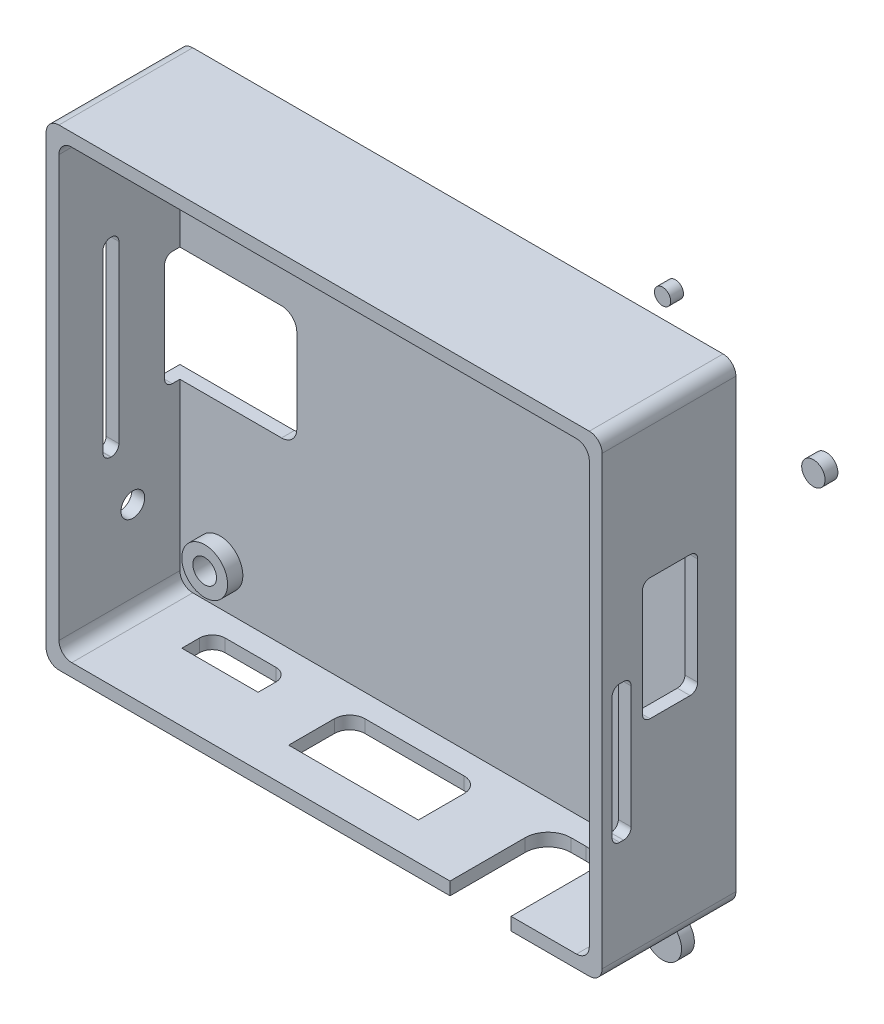
from build123d import *

# Parameters (mm, degrees)
SKETCH_1_R          = 1.531489915
EXTRUDE_1_DEPTH     = 1.68
SKETCH_1_R_2        = 1.063949022
EXTRUDE_1_2_DEPTH   = 1.68
SKETCH_1_R_3        = 2.489250022
EXTRUDE_1_3_DEPTH   = 1.68
SKETCH_1_W          = 72.86
SKETCH_1_H          = 61.86
SKETCH_1_R_4        = 1.55
EXTRUDE_1_4_DEPTH   = 1.68
SKETCH_2_R          = 3
SKETCH_2_R_2        = 1.55
EXTRUDE_3_DEPTH     = 2
SKETCH_3_W          = 72.86
SKETCH_3_H          = 61.86
SKETCH_3_W_2        = 69.50125591
SKETCH_3_H_2        = 58.5
EXTRUDE_4_DEPTH     = 15.85
SKETCH_4_W          = 17
SKETCH_4_H          = 15
CUT_EXTRUDE_1_DEPTH = 3.68
SKETCH_6_W          = 7.25
SKETCH_6_H          = 16
SKETCH_6_W_2        = 2.5
SKETCH_6_H_2        = 18
CUT_EXTRUDE_3_DEPTH = 7.8
SKETCH_7_W          = 10
SKETCH_7_H          = 4
SKETCH_7_W_2        = 17
SKETCH_7_H_2        = 8
SKETCH_7_W_3        = 8
SKETCH_7_H_3        = 13.300256909
CUT_EXTRUDE_5_DEPTH = 2
SKETCH_8_R          = 1.556852558
SKETCH_8_W          = 2.087452415
SKETCH_8_H          = 24.945353107
CUT_EXTRUDE_6_DEPTH = 2
FILLET_1_R          = 1.68
FILLET_2_R          = 2
FILLET_3_R          = 1.68
FILLET_4_R          = 2
FILLET_5_R          = 3
FILLET_6_R          = 1
FILLET_7_R          = 1
SKETCH_9_R          = 4
CUT_EXTRUDE_7_DEPTH = 0.8
SKETCH_10_W         = 44.758598589
SKETCH_10_H         = 6.5
SKETCH_10_W_2       = 44.448850503
CUT_EXTRUDE_8_DEPTH = 0.8


with BuildPart() as part:
    # 草图1 → 凸台-拉伸1 (new body)
    with BuildSketch(Plane.XY):
        with Locations((1.504266973, 51.672660554)):
            Circle(SKETCH_1_R)
    extrude(amount=EXTRUDE_1_DEPTH)


with BuildPart() as body_2:
    # 草图1 → Extrude 1 2 (new body)
    with BuildSketch(Plane.XY):
        with Locations((-18.258772408, 61.840992468)):
            Circle(SKETCH_1_R_2)
    extrude(amount=EXTRUDE_1_2_DEPTH)


with BuildPart() as body_3:
    # 草图1 → Extrude 1 3 (new body)
    with BuildSketch(Plane.XY):
        with Locations((-18.258772408, -10.975845657)):
            Circle(SKETCH_1_R_3)
    extrude(amount=EXTRUDE_1_3_DEPTH)


with BuildPart() as body_4:
    # 草图1 → Extrude 1 4 (new body)
    with BuildSketch(Plane.XY):
        with Locations((-46.758772408, 26.672660554)):
            Rectangle(SKETCH_1_W, SKETCH_1_H)
        with Locations((-76.258772408, 51.672660554)):
            Circle(SKETCH_1_R_4, mode=Mode.SUBTRACT)
        with Locations((-18.258772408, 51.672660554)):
            Circle(SKETCH_1_R_4, mode=Mode.SUBTRACT)
        with Locations((-76.258772408, 2.672660554)):
            Circle(SKETCH_1_R_4, mode=Mode.SUBTRACT)
        with Locations((-18.258772408, 2.672660554)):
            Circle(SKETCH_1_R_4, mode=Mode.SUBTRACT)
    extrude(amount=EXTRUDE_1_4_DEPTH)

    # 草图2 → 凸台-拉伸3 (add)
    # profile 1 of 4: a face of its own
    with BuildSketch(Plane.XY.offset(1.68)):
        with Locations((-76.258772408, 2.672660554)):
            Circle(SKETCH_2_R)
        with Locations((-76.258772408, 2.672660554)):
            Circle(SKETCH_2_R_2, mode=Mode.SUBTRACT)
    # profile 2 of 4: a face of its own
    with BuildSketch(Plane.XY.offset(1.68)):
        with Locations((-18.258772408, 2.672660554)):
            Circle(SKETCH_2_R)
        with Locations((-18.258772408, 2.672660554)):
            Circle(SKETCH_2_R_2, mode=Mode.SUBTRACT)
    # profile 3 of 4: a face of its own
    with BuildSketch(Plane.XY.offset(1.68)):
        with Locations((-76.258772408, 51.672660554)):
            Circle(SKETCH_2_R)
        with Locations((-76.258772408, 51.672660554)):
            Circle(SKETCH_2_R_2, mode=Mode.SUBTRACT)
    # profile 4 of 4: a face of its own
    with BuildSketch(Plane.XY.offset(1.68)):
        with Locations((-18.258772408, 51.672660554)):
            Circle(SKETCH_2_R)
        with Locations((-18.258772408, 51.672660554)):
            Circle(SKETCH_2_R_2, mode=Mode.SUBTRACT)
    extrude(amount=EXTRUDE_3_DEPTH)

    # 草图3 → 凸台-拉伸4 (add)
    with BuildSketch(Plane.XY.offset(1.68)):
        with Locations((-46.758772408, 26.672660554)):
            Rectangle(SKETCH_3_W, SKETCH_3_H)
        with Locations((-46.758144453, 26.672660554)):
            Rectangle(SKETCH_3_W_2, SKETCH_3_H_2, mode=Mode.SUBTRACT)
    extrude(amount=EXTRUDE_4_DEPTH)

    # 草图4 → 切除-拉伸1 (cut)
    with BuildSketch(Plane(origin=(0, 0, 0), x_dir=(-1, 0, 0), z_dir=(0, 0, -1))):
        with Locations((74.688772408, 28.322197805)):
            Rectangle(SKETCH_4_W, SKETCH_4_H)
    extrude(amount=-CUT_EXTRUDE_1_DEPTH, mode=Mode.SUBTRACT)

    # 草图6 → 切除-拉伸3 (cut)
    with BuildSketch(Plane(origin=(-10.328772408, 0, 0), x_dir=(0, 0, -1), z_dir=(1, 0, 0))):
        with Locations((-8.625, 30.672660554)):
            Rectangle(SKETCH_6_W, SKETCH_6_H)
        with Locations((-14.975303343, 19.628822862)):
            Rectangle(SKETCH_6_W_2, SKETCH_6_H_2)
    extrude(amount=-CUT_EXTRUDE_3_DEPTH, mode=Mode.SUBTRACT)

    # 草图7 → 切除-拉伸5 (cut)
    with BuildSketch(Plane.XZ.offset(4.257339446)):
        with Locations((-69.258772408, 6.68)):
            Rectangle(SKETCH_7_W, SKETCH_7_H)
        with Locations((-47.758772408, 8.68)):
            Rectangle(SKETCH_7_W_2, SKETCH_7_H_2)
        with Locations((-26.258772408, 11.330128455)):
            Rectangle(SKETCH_7_W_3, SKETCH_7_H_3)
    extrude(amount=-CUT_EXTRUDE_5_DEPTH, mode=Mode.SUBTRACT)

    # 草图8 → 切除-拉伸6 (cut)
    with BuildSketch(Plane.ZY.offset(83.188772408)):
        with Locations((7.843859074, 9.687980695)):
            Circle(SKETCH_8_R)
        with Locations((10.717951448, 28.982792683)):
            Rectangle(SKETCH_8_W, SKETCH_8_H)
    extrude(amount=-CUT_EXTRUDE_6_DEPTH, mode=Mode.SUBTRACT)

    # 圆角1
    fillet_1_edges = [body_4.edges().sort_by_distance(p)[0] for p in [
        (-12.007516498, 55.922660554, 9.605),
        (-81.508772408, 55.922660554, 9.605),
        (-81.508772408, -2.577339446, 9.605),
        (-12.007516498, -2.577339446, 9.605),
        (-10.328772408, -4.257339446, 8.765),
        (-83.188772408, -4.257339446, 8.765),
        (-83.188772408, 57.602660554, 8.765),
        (-10.328772408, 57.602660554, 8.765),
    ]]
    fillet(fillet_1_edges, radius=FILLET_1_R)

    # 圆角2
    fillet_2_edges = [body_4.edges().sort_by_distance(p)[0] for p in [
        (-66.188772408, 20.822197805, 0.84),
        (-66.188772408, 35.822197805, 0.84),
    ]]
    fillet(fillet_2_edges, radius=FILLET_2_R)

    # 圆角3
    fillet_3_edges = [body_4.edges().sort_by_distance(p)[0] for p in [
        (-74.258772408, -3.417339446, 4.68),
        (-64.258772408, -3.417339446, 4.68),
    ]]
    fillet(fillet_3_edges, radius=FILLET_3_R)

    # 圆角4
    fillet_4_edges = [body_4.edges().sort_by_distance(p)[0] for p in [
        (-56.258772408, -3.417339446, 4.68),
        (-39.258772408, -3.417339446, 4.68),
    ]]
    fillet(fillet_4_edges, radius=FILLET_4_R)

    # 圆角5
    fillet_5_edges = [body_4.edges().sort_by_distance(p)[0] for p in [
        (-30.258772408, -3.417339446, 4.68),
        (-22.258772408, -3.417339446, 4.68),
    ]]
    fillet(fillet_5_edges, radius=FILLET_5_R)

    # 圆角6
    fillet_6_edges = [body_4.edges().sort_by_distance(p)[0] for p in [
        (-11.168144453, 10.628822862, 16.225303343),
        (-11.168144453, 28.628822862, 16.225303343),
        (-11.168144453, 28.628822862, 13.725303343),
        (-11.168144453, 10.628822862, 13.725303343),
    ]]
    fillet(fillet_6_edges, radius=FILLET_6_R)

    # 圆角7
    fillet_7_edges = [body_4.edges().sort_by_distance(p)[0] for p in [
        (-11.168144453, 38.672660554, 5),
        (-11.168144453, 22.672660554, 5),
        (-11.168144453, 22.672660554, 12.25),
        (-11.168144453, 38.672660554, 12.25),
        (-82.348772408, 16.510116129, 9.67422524),
        (-82.348772408, 41.455469236, 9.67422524),
        (-82.348772408, 41.455469236, 11.761677655),
        (-82.348772408, 16.510116129, 11.761677655),
        (-82.348772408, 20.822197805, 3.68),
        (-82.348772408, 35.822197805, 3.68),
    ]]
    fillet(fillet_7_edges, radius=FILLET_7_R)

    # 草图9 → 切除-拉伸7 (cut)
    with BuildSketch(Plane(origin=(0, 0, 0), x_dir=(-1, 0, 0), z_dir=(0, 0, -1))):
        with Locations((18.258772408, 51.672660554)):
            Circle(SKETCH_9_R)
        with Locations((76.258772408, 51.672660554)):
            Circle(SKETCH_9_R)
        with Locations((18.258772408, 2.672660554)):
            Circle(SKETCH_9_R)
        with Locations((76.258772408, 2.672660554)):
            Circle(SKETCH_9_R)
    extrude(amount=-CUT_EXTRUDE_7_DEPTH, mode=Mode.SUBTRACT)

    # 草图10 → 切除-拉伸8 (cut)
    with BuildSketch(Plane(origin=(0, 0, 0), x_dir=(-1, 0, 0), z_dir=(0, 0, -1))):
        with Locations((41.37196271, 38.672660554)):
            Rectangle(SKETCH_10_W, SKETCH_10_H)
        with Locations((41.37196271, 14.672660554)):
            Rectangle(SKETCH_10_W_2, SKETCH_10_H)
    extrude(amount=-CUT_EXTRUDE_8_DEPTH, mode=Mode.SUBTRACT)


solid = Compound([part.part, body_2.part, body_3.part, body_4.part])
